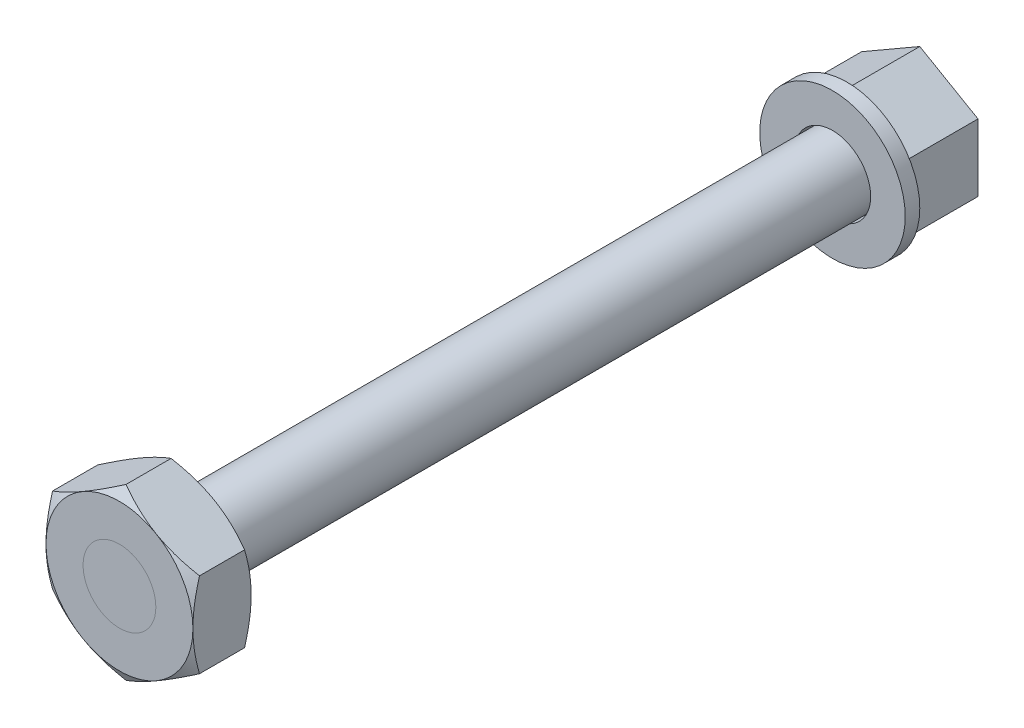
from build123d import *

# Parameters (mm, degrees)
SKETCH1_R           = 5
BOSS_EXTRUDE1_DEPTH = 10
BOSS_EXTRUDE2_START = 10
SKETCH1_3_R         = 5
BOSS_EXTRUDE2_DEPTH = 100
BOSS_EXTRUDE3_START = 10
SKETCH3_R           = 10
SKETCH3_R_2         = 5.25
BOSS_EXTRUDE3_DEPTH = 2
SKETCH4_R           = 5
BOSS_EXTRUDE4_DEPTH = 8


with BuildPart() as part:
    # Sketch1 → Boss-Extrude1 (new body)
    # profile 1 of 2: a face of its own
    with BuildSketch(Plane.XY):
        Polygon((-11.163210479, -1.701501358), (-3.163210479, 2.917300796), (-3.163210479, 12.154905103), (-11.163210479, 16.773707256), (-19.163210479, 12.154905103), (-19.163210479, 2.917300796), align=None)
        with Locations((-11.163210479, 7.536102949)):
            Circle(SKETCH1_R, mode=Mode.SUBTRACT)
    # profile 2 of 2: a face of its own
    with BuildSketch(Plane.XY):
        with Locations((-11.163210479, 7.536102949)):
            Circle(SKETCH1_R)
    extrude(amount=BOSS_EXTRUDE1_DEPTH)

    # Sketch1<3> → Boss-Extrude2 (add)
    with BuildSketch(Plane.XY.offset(BOSS_EXTRUDE2_START)):
        with Locations((-11.163210479, 7.536102949)):
            Circle(SKETCH1_3_R)
    extrude(amount=BOSS_EXTRUDE2_DEPTH)


with BuildPart() as body_2:
    # Sketch3 → Boss-Extrude3 (new body)
    with BuildSketch(Plane.XY.offset(BOSS_EXTRUDE3_START)):
        with Locations((-11.163210479, 7.536102949)):
            Circle(SKETCH3_R)
        with Locations((-11.163210479, 7.536102949)):
            Circle(SKETCH3_R_2, mode=Mode.SUBTRACT)
    extrude(amount=BOSS_EXTRUDE3_DEPTH)


with BuildPart() as body_3:
    # Sketch4 → Boss-Extrude4 (new body)
    with BuildSketch(Plane.XY.offset(110)):
        Polygon((-11.163210479, -4.123618998), (-1.065595071, 1.706241975), (-1.065595071, 13.365963923), (-11.163210479, 19.195824897), (-21.260825886, 13.365963923), (-21.260825886, 1.706241975), align=None)
        with Locations((-11.163210479, 7.536102949)):
            Circle(SKETCH4_R, mode=Mode.SUBTRACT)
    extrude(amount=-BOSS_EXTRUDE4_DEPTH)

    # Sketch5 → Cut-Revolve1 (revolve, cut)
    with BuildSketch(Plane(origin=(0, 7.536102949, 0), x_dir=(-1, 0, 0), z_dir=(0, -1, 0))):
        Polygon((28.189029116, -106), (14.332622656, -114), (14.332622656, -118.5), (39.332622656, -118.5), (39.332622656, -93.5), (14.332622656, -93.5), (14.332622656, -98), align=None)
    revolve(axis=Axis((-11.163210479, 7.536102949, 111.6), (0, 0, 1)), mode=Mode.SUBTRACT)


solid = Compound([part.part, body_2.part, body_3.part])
